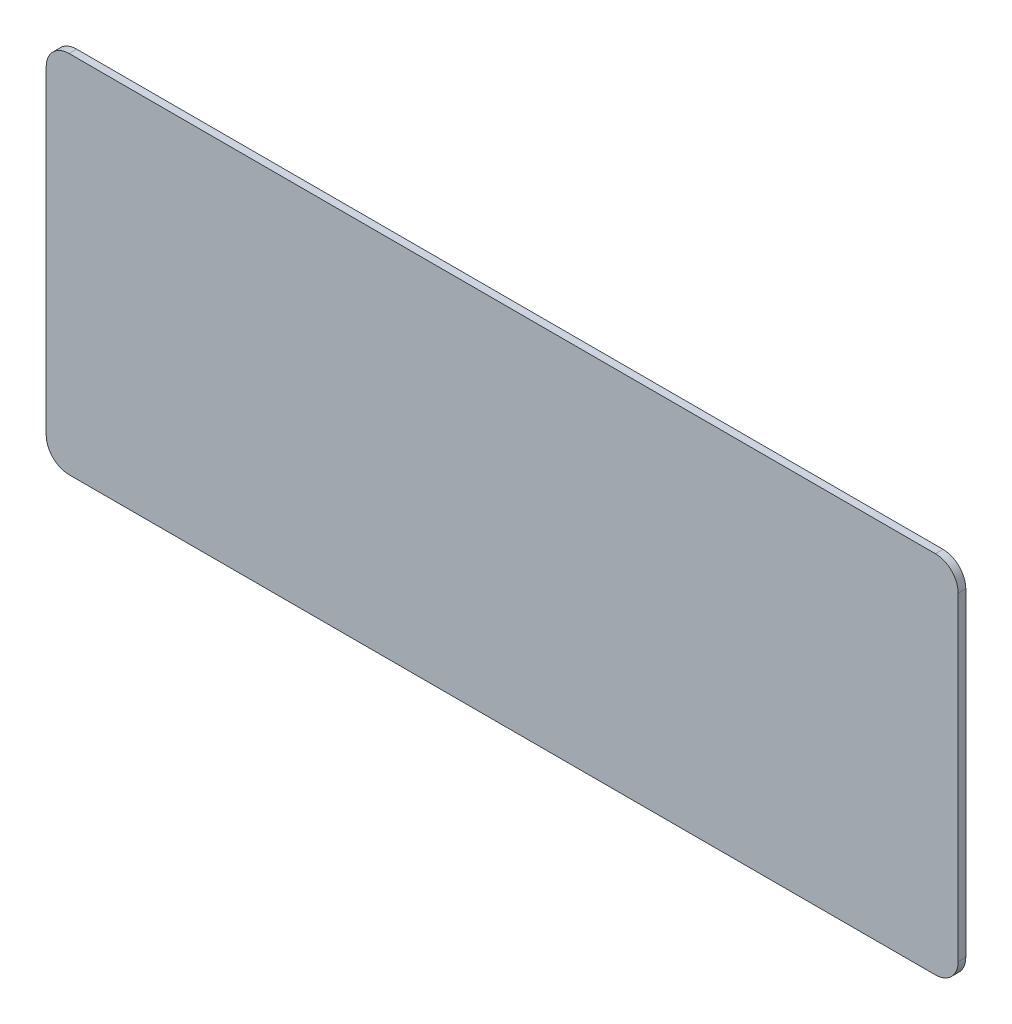
from build123d import *

# Parameters (mm, degrees)
BOSS_EXTRUDE1_DEPTH = 1


with BuildPart() as part:
    # Sketch1 → Boss-Extrude1 (new body)
    with BuildSketch(Plane.XY):
        with BuildLine():
            Line((-51.940144553, -23.805569529), (62.059855447, -23.805569529))
            ThreePointArc((62.059855447, -23.805569529), (64.18117579, -22.926889873), (65.059855447, -20.805569529))
            Line((65.059855447, -20.805569529), (65.059855447, 0.194430471))
            Line((65.059855447, 0.194430471), (65.059855447, 21.194430471))
            ThreePointArc((65.059855447, 21.194430471), (64.18117579, 23.315750814), (62.059855447, 24.194430471))
            Line((62.059855447, 24.194430471), (-51.940144553, 24.194430471))
            ThreePointArc((-51.940144553, 24.194430471), (-54.061464897, 23.315750814), (-54.940144553, 21.194430471))
            Line((-54.940144553, 21.194430471), (-54.940144553, 0.194430471))
            Line((-54.940144553, 0.194430471), (-54.940144553, -20.805569529))
            ThreePointArc((-54.940144553, -20.805569529), (-54.061464897, -22.926889873), (-51.940144553, -23.805569529))
        make_face()
    extrude(amount=BOSS_EXTRUDE1_DEPTH)


solid = part.part
